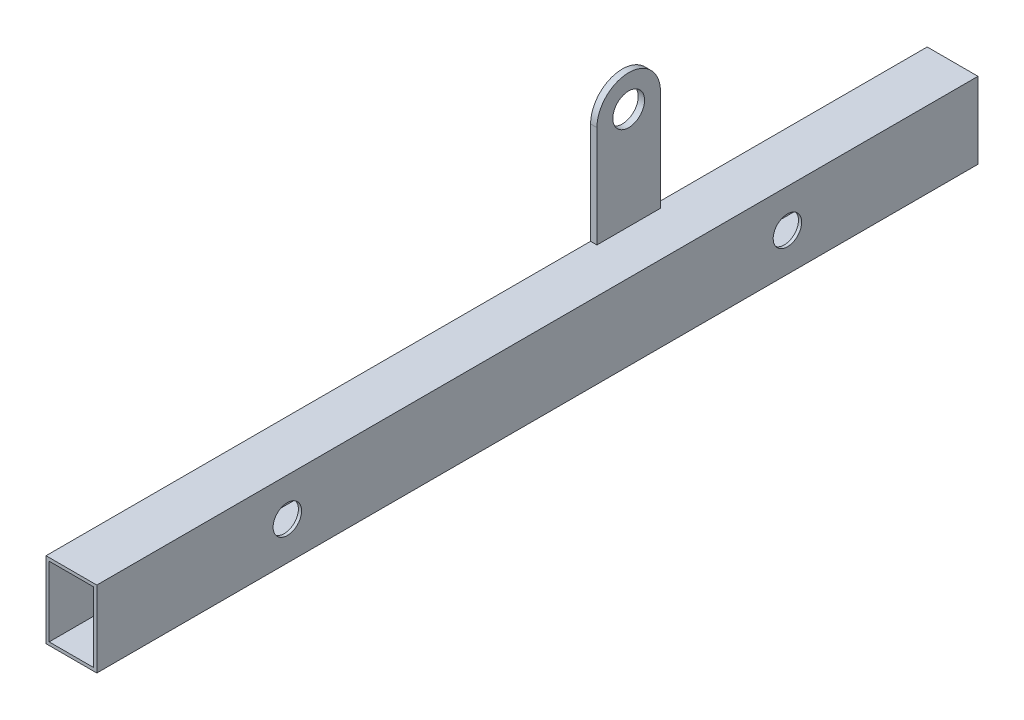
from build123d import *

# Parameters (mm, degrees)
SKETCH1_W           = 50.8
SKETCH1_H           = 76.2
SKETCH1_W_2         = 44.45
SKETCH1_H_2         = 69.85
BOSS_EXTRUDE1_DEPTH = 965.2
CUT_EXTRUDE1_REACH  = 969.287
SKETCH4_R           = 14.224
SKETCH5_R           = 3.175
CUT_EXTRUDE2_DEPTH  = 3.175
CUT_EXTRUDE3_REACH  = 969.287
SKETCH6_W           = 84.151951589
SKETCH6_H           = 76.2
SKETCH7_R           = 15.875
BOSS_EXTRUDE2_DEPTH = 6.35


with BuildPart() as part:
    # Sketch1 → Boss-Extrude1 (new body)
    with BuildSketch(Plane.XY):
        Rectangle(SKETCH1_W, SKETCH1_H)
        Rectangle(SKETCH1_W_2, SKETCH1_H_2, mode=Mode.SUBTRACT)
    extrude(amount=BOSS_EXTRUDE1_DEPTH)

    # Cut-Extrude1: up to this face of the body (flat: up to its plane)
    cut_extrude1_end = Plane(part.part.faces().sort_by_distance((-25.4, 0, 482.6))[0])
    # Sketch4 → Cut-Extrude1 (cut, up to the picked face)
    with BuildSketch(Plane(origin=(25.4, 0, 0), x_dir=(0, 0, -1), z_dir=(1, 0, 0)), mode=Mode.PRIVATE) as cut_extrude1_sk1:
        with Locations(Location((-690.548048411, 0, 0), (0, 0, 90))):
            Circle(SKETCH4_R)
    cut_extrude1_tool1 = split(extrude(cut_extrude1_sk1.sketch, amount=-CUT_EXTRUDE1_REACH, mode=Mode.PRIVATE), bisect_by=cut_extrude1_end, keep=Keep.BOTH, mode=Mode.PRIVATE)
    # Sketch4 → Cut-Extrude1 (cut, up to the picked face)
    with BuildSketch(Plane(origin=(25.4, 0, 0), x_dir=(0, 0, -1), z_dir=(1, 0, 0)), mode=Mode.PRIVATE) as cut_extrude1_sk2:
        with Locations(Location((-190.549048411, 0, 0), (0, 0, 90))):
            Circle(SKETCH4_R)
    cut_extrude1_tool2 = split(extrude(cut_extrude1_sk2.sketch, amount=-CUT_EXTRUDE1_REACH, mode=Mode.PRIVATE), bisect_by=cut_extrude1_end, keep=Keep.BOTH, mode=Mode.PRIVATE)
    add(cut_extrude1_tool1.solids().sort_by(Axis((25.4, 0, 690.548048), (-1, 0, 0)))[0], mode=Mode.SUBTRACT)
    add(cut_extrude1_tool2.solids().sort_by(Axis((25.4, 0, 190.549048), (-1, 0, 0)))[0], mode=Mode.SUBTRACT)

    # Sketch5 → Cut-Extrude2 (cut)
    with BuildSketch(Plane.XZ.offset(38.1)):
        with Locations(Location((-19.05, 276.86, 0), (0, 0, 270))):
            Circle(SKETCH5_R)
        with Locations(Location((-19.05, 289.56, 0), (0, 0, 270))):
            Circle(SKETCH5_R)
        with Locations((19.05, 276.86)):
            Circle(SKETCH5_R)
        with Locations((19.05, 289.56)):
            Circle(SKETCH5_R)
        with Locations(Location((0, 410.718, 0), (0, 0, 270))):
            Circle(SKETCH5_R)
        with Locations(Location((0, 580.898, 0), (0, 0, 270))):
            Circle(SKETCH5_R)
        with Locations(Location((0, 495.808, 0), (0, 0, 270))):
            Circle(SKETCH5_R)
    extrude(amount=-CUT_EXTRUDE2_DEPTH, mode=Mode.SUBTRACT)

    # Cut-Extrude3: up to this face of the body (flat: up to its plane)
    cut_extrude3_end = Plane(part.part.faces().sort_by_distance((-25.4, 0, 483.339612352))[0])
    # Sketch6 → Cut-Extrude3 (cut, up to the picked face)
    with BuildSketch(Plane(origin=(25.4, 0, 0), x_dir=(0, 0, -1), z_dir=(1, 0, 0)), mode=Mode.PRIVATE) as cut_extrude3_sk1:
        with Locations((-923.124024206, 0)):
            Rectangle(SKETCH6_W, SKETCH6_H)
    cut_extrude3_tool1 = split(extrude(cut_extrude3_sk1.sketch, amount=-CUT_EXTRUDE3_REACH, mode=Mode.PRIVATE), bisect_by=cut_extrude3_end, keep=Keep.BOTH, mode=Mode.PRIVATE)
    add(cut_extrude3_tool1.solids().sort_by(Axis((25.4, 0, 923.124024), (-1, 0, 0)))[0], mode=Mode.SUBTRACT)

    # Sketch7 → Boss-Extrude2 (add)
    with BuildSketch(Plane.ZY.offset(25.4)):
        with BuildLine():
            Line((336.55, 139.7), (336.55, 38.1))
            Line((336.55, 38.1), (273.05, 38.1))
            Line((273.05, 38.1), (273.05, 139.7))
            ThreePointArc((273.05, 139.7), (304.8, 171.45), (336.55, 139.7))
        make_face()
        with Locations(Location((304.8, 139.7, 0), (0, 0, 270))):
            Circle(SKETCH7_R, mode=Mode.SUBTRACT)
    extrude(amount=-BOSS_EXTRUDE2_DEPTH)


solid = part.part
